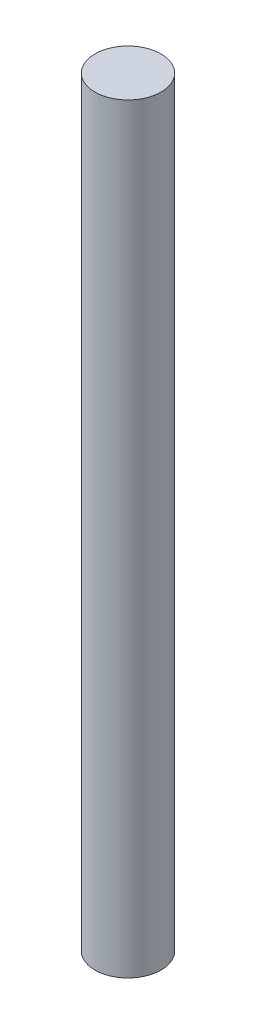
from build123d import *

# Parameters (mm, degrees)
SKETCH2_R           = 4
BOSS_EXTRUDE1_DEPTH = 92


with BuildPart() as part:
    # Sketch2 → Boss-Extrude1 (new body)
    with BuildSketch(Plane(origin=(0, 0, 0), x_dir=(1, 0, 0), z_dir=(0, 1, 0))):
        with Locations(Location((0, 0, 0), (0, 0, 270))):
            Circle(SKETCH2_R)
    extrude(amount=BOSS_EXTRUDE1_DEPTH)


solid = part.part
